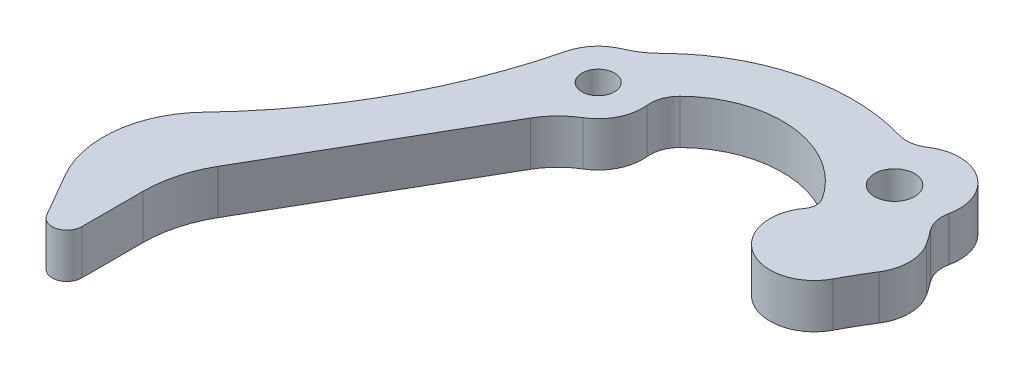
from build123d import *
from OCP.BRepFilletAPI import BRepFilletAPI_MakeFillet

# Parameters (mm, degrees)
SKETCH_1_R      = 1.1
SKETCH_1_R_2    = 1.35
EXTRUDE_1_DEPTH = 3
EXTRUDE_START   = -3
SKETCH_3_R      = 1.1
EXTRUDE_3_DEPTH = 3
FILLET_2_R1     = 5
FILLET_2_R2     = 2
FILLET_2_R3     = 1
FILLET_2_R4     = 30
FILLET_5_R1     = 8
FILLET_5_R2     = 1
EXTRUDE_4_DEPTH = 3
FILLET_6_R      = 2


with BuildPart() as part:
    # 草图1 → 凸台-拉伸1 (new body)
    # profile 1 of 2: a face of its own
    with BuildSketch(Plane(origin=(0, 0, 0), x_dir=(1, 0, 0), z_dir=(0, 1, 0))):
        with BuildLine():
            ThreePointArc((20.525, 1.619992284), (9.210909522, 7.594690029), (-1.742424242, 0.981813505))
            ThreePointArc((-1.742424242, 0.981813505), (-0.831280947, -1.819057994), (1.882716049, -0.6748187))
            ThreePointArc((1.882716049, -0.6748187), (8.068871386, 3.95168534), (14.746234429, 0.067630724))
            ThreePointArc((14.746234429, 0.067630724), (14.962422497, -0.414223398), (15.141666667, -0.911005245))
            ThreePointArc((15.141666667, -0.911005245), (17.049420643, -2.845417172), (19.736805453, -2.446120769))
            ThreePointArc((19.736805453, -2.446120769), (20.945176611, -0.570906936), (20.525, 1.619992284))
        make_face()
        with Locations(Location((0, 0, 0), (0, 0, 270))):
            Circle(SKETCH_1_R, mode=Mode.SUBTRACT)
        with Locations(Location((16, 4, 0), (0, 0, 270))):
            Circle(SKETCH_1_R_2, mode=Mode.SUBTRACT)
    # profile 2 of 2: a face of its own
    with BuildSketch(Plane(origin=(0, 0, 0), x_dir=(1, 0, 0), z_dir=(0, 1, 0))):
        with BuildLine():
            ThreePointArc((15.141666667, -0.911005245), (14.962422497, -0.414223398), (14.746234429, 0.067630724))
            ThreePointArc((14.746234429, 0.067630724), (15.400433961, -4.844367805), (19.736805453, -2.446120769))
            ThreePointArc((19.736805453, -2.446120769), (17.049420643, -2.845417172), (15.141666667, -0.911005245))
        make_face()
    extrude(amount=EXTRUDE_1_DEPTH)

    # 草图3 → 凸台-拉伸3 (add)
    with BuildSketch(Plane(origin=(0, 3, 0), x_dir=(1, 0, 0), z_dir=(0, 1, 0)).offset(EXTRUDE_START)):
        with BuildLine():
            Line((0.614016819, -2.936491673), (-9, -19.588457268))
            Line((-9, -19.588457268), (-9, -29.588457268))
            Line((-9, -29.588457268), (-12.578803063, -23.389788533))
            ThreePointArc((-12.578803063, -23.389788533), (-13.466780589, -19.055917696), (-11.578817768, -15.055100666))
            ThreePointArc((-11.578817768, -15.055100666), (-6.214207535, -7.734234659), (-2.912351086, 0.719868842))
            ThreePointArc((-2.912351086, 0.719868842), (2.159358274, 2.082587776), (0.614016819, -2.936491673))
        make_face()
        with Locations(Location((0, 0, 0), (0, 0, 270))):
            Circle(SKETCH_3_R, mode=Mode.SUBTRACT)
    extrude(amount=EXTRUDE_3_DEPTH)

    # 圆角2: one fillet with a radius per group of edges: ONE call of the kernel's fillet builder (fillet() takes one radius for all edges)
    fillet_2_edges_1 = [part.edges().sort_by_distance(p)[0] for p in [
        (-0.356321868, 1.5, -2.97876396),
        (0.614016819, 1.5, 2.936491673),
    ]]
    fillet_2_edges_2 = [part.edges().sort_by_distance(p)[0] for p in [
        (2.802950535, 1.5, -1.069330773),
    ]]
    fillet_2_edges_3 = [part.edges().sort_by_distance(p)[0] for p in [
        (14.746234429, 1.5, -0.067630724),
    ]]
    fillet_2_edges_4 = [part.edges().sort_by_distance(p)[0] for p in [
        (19.736805453, 1.5, 2.446120769),
    ]]
    fillet_2 = BRepFilletAPI_MakeFillet(part.part.solid().wrapped)
    for e in fillet_2_edges_1:
        fillet_2.Add(FILLET_2_R1, e.wrapped)
    for e in fillet_2_edges_2:
        fillet_2.Add(FILLET_2_R2, e.wrapped)
    for e in fillet_2_edges_3:
        fillet_2.Add(FILLET_2_R3, e.wrapped)
    for e in fillet_2_edges_4:
        fillet_2.Add(FILLET_2_R4, e.wrapped)
    add(Compound.cast(fillet_2.Shape()), mode=Mode.REPLACE)

    # 圆角5: one fillet with a radius per group of edges: ONE call of the kernel's fillet builder (fillet() takes one radius for all edges)
    fillet_5_edges_1 = [part.edges().sort_by_distance(p)[0] for p in [
        (-9, 1.5, 19.588457268),
    ]]
    fillet_5_edges_2 = [part.edges().sort_by_distance(p)[0] for p in [
        (-9, 1.5, 29.588457268),
    ]]
    fillet_5 = BRepFilletAPI_MakeFillet(part.part.solid().wrapped)
    for e in fillet_5_edges_1:
        fillet_5.Add(FILLET_5_R1, e.wrapped)
    for e in fillet_5_edges_2:
        fillet_5.Add(FILLET_5_R2, e.wrapped)
    add(Compound.cast(fillet_5.Shape()), mode=Mode.REPLACE)

    # 草图4 → 凸台-拉伸4 (add)
    with BuildSketch(Plane(origin=(0, 3, 0), x_dir=(1, 0, 0), z_dir=(0, 1, 0)).offset(EXTRUDE_START)):
        with BuildLine():
            ThreePointArc((19.184075551, 3.365055605), (16.912631767, 5.336942618), (14.2487975, 6.734004627))
            ThreePointArc((14.2487975, 6.734004627), (18.255168749, 7.303666738), (19.184075551, 3.365055605))
        make_face()
    extrude(amount=EXTRUDE_4_DEPTH)

    # 圆角6
    fillet_6_edges = [part.edges().sort_by_distance(p)[0] for p in [
        (14.2487975, 1.5, -6.734004627),
        (19.184075551, 1.5, -3.365055605),
    ]]
    fillet(fillet_6_edges, radius=FILLET_6_R)


solid = part.part
